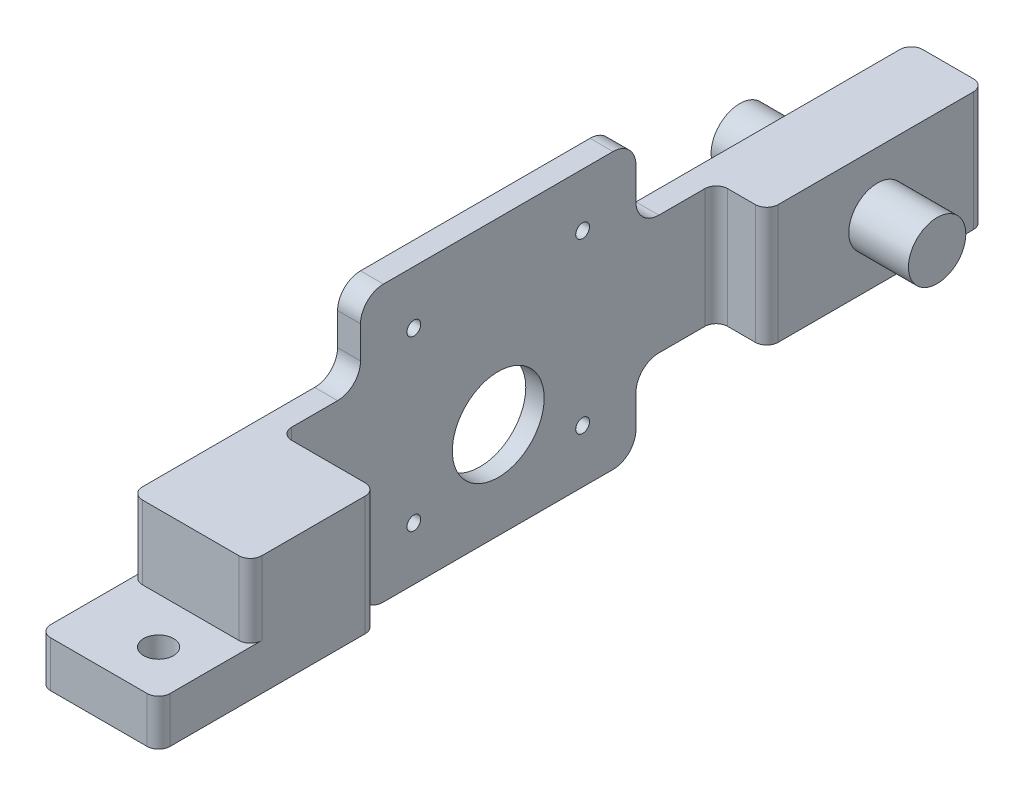
from build123d import *

# Parameters (mm, degrees)
SKETCH_1_W                  = 52
SKETCH_1_H                  = 380
EXTRUDE_1_DEPTH             = 52
SKETCH_2_W                  = 42
SKETCH_2_H                  = 285
CUT_EXTRUDE_1_DEPTH         = 204.735122156
SKETCH_3_W                  = 95
SKETCH_3_H                  = 52
EXTRUDE_2_DEPTH             = 22
SKETCH_4_W                  = 10
SKETCH_4_H                  = 120
EXTRUDE_3_DEPTH             = 34
SKETCH_5_W                  = 10
SKETCH_5_H                  = 120
EXTRUDE_4_DEPTH             = 34
SKETCH_6_W                  = 40
SKETCH_6_H                  = 32
CUT_EXTRUDE_2_DEPTH         = 206.922315449
SKETCH_7_W                  = 91
SKETCH_7_H                  = 91
CUT_EXTRUDE_3_DEPTH         = 2
SKETCH_8_W                  = 28
SKETCH_8_H                  = 12.5
SKETCH_9_W                  = 26
SKETCH_9_H                  = 12.5
HOLE_WIZARD_13_0_13_1_D     = 13
HOLE_WIZARD_13_0_13_1_DEPTH = 86
HOLE_WIZARD_M39_1_D         = 40
HOLE_WIZARD_M39_1_DEPTH     = 38
HOLE_WIZARD_6_0_6_1_D       = 6
HOLE_WIZARD_6_0_6_1_DEPTH   = 38
FILLET_1_R                  = 5
FILLET_2_R                  = 10


with BuildPart() as part:
    # 草图1 → 凸台-拉伸1 (new body)
    with BuildSketch(Plane(origin=(0, 26, 0), x_dir=(1, 0, 0), z_dir=(0, 1, 0))):
        with Locations((26, 0)):
            Rectangle(SKETCH_1_W, SKETCH_1_H)
    extrude(amount=-EXTRUDE_1_DEPTH)

    # 草图2 → 切除-拉伸1 (cut, through all)
    with BuildSketch(Plane(origin=(0, 26, 0), x_dir=(-1, 0, 0), z_dir=(0, 1, 0))):
        with Locations((-31, -47.5)):
            Rectangle(SKETCH_2_W, SKETCH_2_H)
    extrude(amount=-CUT_EXTRUDE_1_DEPTH, mode=Mode.SUBTRACT)

    # 草图3 → 凸台-拉伸2 (add)
    with BuildSketch(Plane(origin=(10, 0, 0), x_dir=(0, 0, -1), z_dir=(1, 0, 0))):
        with Locations((142.5, 0)):
            Rectangle(SKETCH_3_W, SKETCH_3_H)
    extrude(amount=EXTRUDE_2_DEPTH)

    # 草图4 → 凸台-拉伸3 (add)
    with BuildSketch(Plane(origin=(0, 26, 0), x_dir=(-1, 0, 0), z_dir=(0, 1, 0))):
        with Locations((-5, 0)):
            Rectangle(SKETCH_4_W, SKETCH_4_H)
    extrude(amount=EXTRUDE_3_DEPTH)

    # 草图5 → 凸台-拉伸4 (add)
    with BuildSketch(Plane.XZ.offset(26)):
        with Locations((5, 0)):
            Rectangle(SKETCH_5_W, SKETCH_5_H)
    extrude(amount=EXTRUDE_4_DEPTH)

    # 草图6 → 切除-拉伸2 (cut, through all)
    with BuildSketch(Plane.ZY):
        with Locations((170, 10)):
            Rectangle(SKETCH_6_W, SKETCH_6_H)
    extrude(amount=-CUT_EXTRUDE_2_DEPTH, mode=Mode.SUBTRACT)

    # 草图7 → 切除-拉伸3 (cut)
    with BuildSketch(Plane.ZY):
        Rectangle(SKETCH_7_W, SKETCH_7_H)
    extrude(amount=-CUT_EXTRUDE_3_DEPTH, mode=Mode.SUBTRACT)

    # 草图8 → 旋转1 (revolve)
    with BuildSketch(Plane.XY.offset(-143.248009954), mode=Mode.PRIVATE) as revolve_1_sk:
        with Locations((-14, 6.25)):
            Rectangle(SKETCH_8_W, SKETCH_8_H)
    revolve(revolve_1_sk.sketch.rotate(Axis((-28, 0, -143.248009954), (1, 0, 0)), 270), axis=Axis((-28, 0, -143.248009954), (1, 0, 0)))

    # 草图9 → 旋转2 (revolve)
    with BuildSketch(Plane.XY.offset(-143.248009954), mode=Mode.PRIVATE) as revolve_2_sk:
        with Locations((45, 6.25)):
            Rectangle(SKETCH_9_W, SKETCH_9_H)
    revolve(revolve_2_sk.sketch.rotate(Axis((32, 0, -143.248009954), (1, 0, 0)), 270), axis=Axis((32, 0, -143.248009954), (1, 0, 0)))

    # Ø13.0 (13) 直径孔1
    with Locations(Plane(origin=(0, -26, 0), x_dir=(-1, 0, 0), z_dir=(0, -1, 0))):
        with Locations((-32, -170)):
            Hole(HOLE_WIZARD_13_0_13_1_D / 2, depth=HOLE_WIZARD_13_0_13_1_DEPTH)

    # M39 螺旋的螺纹孔钻头1
    with Locations(Plane(origin=(10, 0, 0), x_dir=(0, 0, -1), z_dir=(1, 0, 0))):
        with Locations((0, -18)):
            Hole(HOLE_WIZARD_M39_1_D / 2, depth=HOLE_WIZARD_M39_1_DEPTH)

    # Ø6.0 (6) 直径孔1
    with Locations(Plane(origin=(10, 0, 0), x_dir=(0, 0, -1), z_dir=(1, 0, 0))):
        with Locations((36.77, 36.77), (36.77, -36.77), (-36.77, -36.77), (-36.77, 36.77)):
            Hole(HOLE_WIZARD_6_0_6_1_D / 2, depth=HOLE_WIZARD_6_0_6_1_DEPTH)

    # 圆角1
    fillet_1_edges = [part.edges().sort_by_distance(p)[0] for p in [
        (52, 0, 95),
        (10, 0, 95),
        (10, 0, -95),
        (32, 0, -190),
        (32, 0, -95),
        (52, 10, 150),
        (0, 10, 150),
        (0, -16, 190),
        (0, 0, -190),
        (52, -16, 190),
        (1, 45.5, -45.5),
        (1, 45.5, 45.5),
        (1, -45.5, 45.5),
        (1, -45.5, -45.5),
    ]]
    fillet(fillet_1_edges, radius=FILLET_1_R)

    # 圆角2
    fillet_2_edges = [part.edges().sort_by_distance(p)[0] for p in [
        (5, 26, 60),
        (5, 26, -60),
        (5, 60, 60),
        (5, 60, -60),
        (5, -26, -60),
        (5, -26, 60),
        (5, -60, -60),
        (5, -60, 60),
    ]]
    fillet(fillet_2_edges, radius=FILLET_2_R)


solid = part.part
